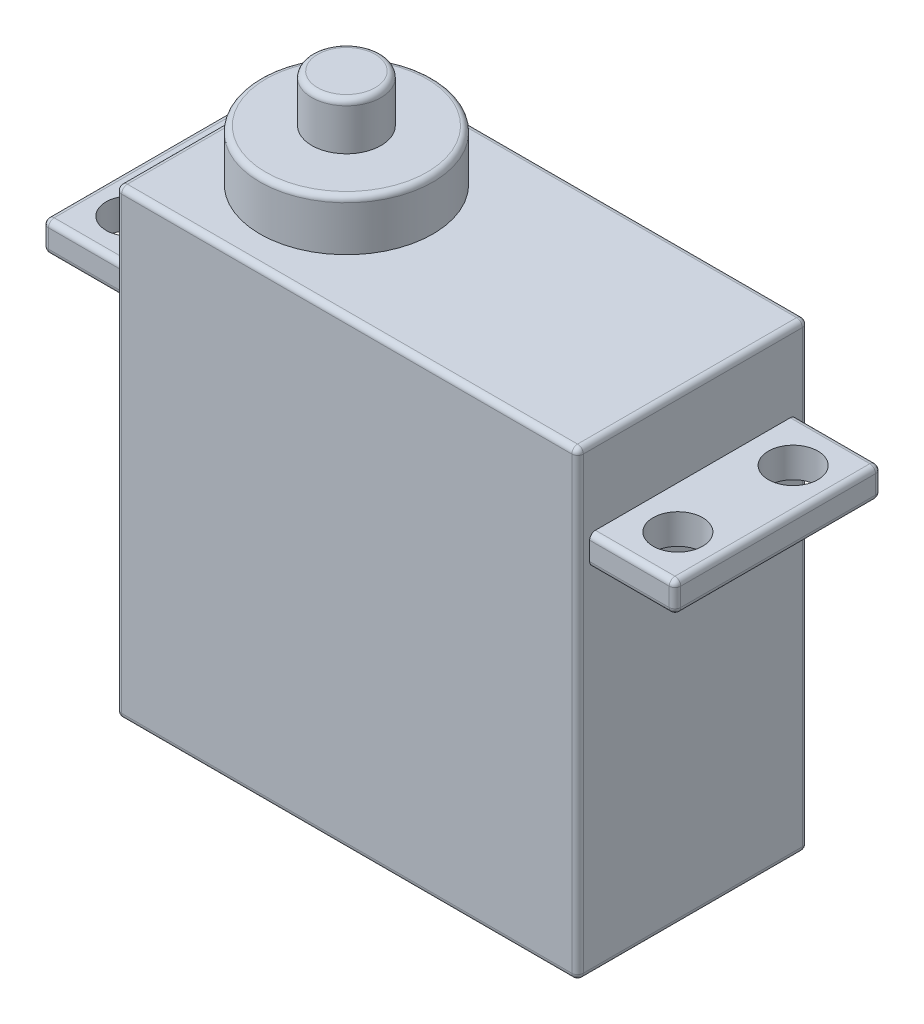
from build123d import *

# Parameters (mm, degrees)
SKETCH1_W           = 40.05
SKETCH1_H           = 20
SKETCH1_R           = 7.5
SKETCH1_R_2         = 3
BOSS_EXTRUDE1_DEPTH = 40
BOSS_EXTRUDE2_START = -6.75
SKETCH1_3_W         = 7.4
SKETCH1_3_H         = 17.9
SKETCH1_3_R         = 2.15
BOSS_EXTRUDE2_DEPTH = 2.6
SKETCH1_4_R         = 7.5
SKETCH1_4_R_2       = 3
BOSS_EXTRUDE3_DEPTH = 4.4
BOSS_EXTRUDE4_START = 4.4
SKETCH1_5_R         = 3
BOSS_EXTRUDE4_DEPTH = 4.1
FILLET1_R           = 0.5


with BuildPart() as part:
    # Sketch1 → Boss-Extrude1 (new body)
    # profile 1 of 3: a face of its own
    with BuildSketch(Plane(origin=(0, 0, 0), x_dir=(1, 0, 0), z_dir=(0, 1, 0))):
        Rectangle(SKETCH1_W, SKETCH1_H)
        with Locations((-10.025, 0)):
            Circle(SKETCH1_R, mode=Mode.SUBTRACT)
    # profile 2 of 3: a face of its own
    with BuildSketch(Plane(origin=(0, 0, 0), x_dir=(1, 0, 0), z_dir=(0, 1, 0))):
        with Locations((-10.025, 0)):
            Circle(SKETCH1_R)
        with Locations((-10.025, 0)):
            Circle(SKETCH1_R_2, mode=Mode.SUBTRACT)
    # profile 3 of 3: a face of its own
    with BuildSketch(Plane(origin=(0, 0, 0), x_dir=(1, 0, 0), z_dir=(0, 1, 0))):
        with Locations((-10.025, 0)):
            Circle(SKETCH1_R_2)
    extrude(amount=-BOSS_EXTRUDE1_DEPTH)

    # Sketch1<3> → Boss-Extrude2 (add)
    # profile 1 of 2: a face of its own
    with BuildSketch(Plane(origin=(0, 0, 0), x_dir=(1, 0, 0), z_dir=(0, 1, 0)).offset(BOSS_EXTRUDE2_START)):
        with Locations((-23.725, 0)):
            Rectangle(SKETCH1_3_W, SKETCH1_3_H)
        with Locations(Location((-23.725, -5, 0), (0, 0, 270))):
            Circle(SKETCH1_3_R, mode=Mode.SUBTRACT)
        with Locations(Location((-23.725, 5, 0), (0, 0, 270))):
            Circle(SKETCH1_3_R, mode=Mode.SUBTRACT)
    # profile 2 of 2: a face of its own
    with BuildSketch(Plane(origin=(0, 0, 0), x_dir=(1, 0, 0), z_dir=(0, 1, 0)).offset(BOSS_EXTRUDE2_START)):
        with Locations((23.725, 0)):
            Rectangle(SKETCH1_3_W, SKETCH1_3_H)
        with Locations(Location((23.725, -5, 0), (0, 0, 270))):
            Circle(SKETCH1_3_R, mode=Mode.SUBTRACT)
        with Locations(Location((23.725, 5, 0), (0, 0, 270))):
            Circle(SKETCH1_3_R, mode=Mode.SUBTRACT)
    extrude(amount=-BOSS_EXTRUDE2_DEPTH)

    # Sketch1<4> → Boss-Extrude3 (add)
    # profile 1 of 2: a face of its own
    with BuildSketch(Plane(origin=(0, 0, 0), x_dir=(1, 0, 0), z_dir=(0, 1, 0))):
        with Locations(Location((-10.025, 0, 0), (0, 0, 270))):
            Circle(SKETCH1_4_R)
        with Locations((-10.025, 0)):
            Circle(SKETCH1_4_R_2, mode=Mode.SUBTRACT)
    # profile 2 of 2: a face of its own
    with BuildSketch(Plane(origin=(0, 0, 0), x_dir=(1, 0, 0), z_dir=(0, 1, 0))):
        with Locations((-10.025, 0)):
            Circle(SKETCH1_4_R_2)
    extrude(amount=BOSS_EXTRUDE3_DEPTH)

    # Sketch1<5> → Boss-Extrude4 (add)
    with BuildSketch(Plane(origin=(0, 0, 0), x_dir=(1, 0, 0), z_dir=(0, 1, 0)).offset(BOSS_EXTRUDE4_START)):
        with Locations(Location((-10.025, 0, 0), (0, 0, 270))):
            Circle(SKETCH1_5_R)
    extrude(amount=BOSS_EXTRUDE4_DEPTH)

    # Fillet1
    fillet1_edges = [part.edges().sort_by_distance(p)[0] for p in [
        (20.025, -40, 0),
        (0, -40, -10),
        (-27.425, -6.75, 0),
        (-27.425, -8.05, 8.95),
        (-23.725, -9.35, -8.95),
        (-27.425, -8.05, -8.95),
        (-23.725, -6.75, 8.95),
        (-20.025, -40, 0),
        (-27.425, -9.35, 0),
        (-23.725, -9.35, 8.95),
        (-23.725, -6.75, -8.95),
        (23.725, -6.75, -8.95),
        (27.425, -9.35, 0),
        (27.425, -8.05, -8.95),
        (23.725, -9.35, 8.95),
        (27.425, -8.05, 8.95),
        (23.725, -9.35, -8.95),
        (23.725, -6.75, 8.95),
        (27.425, -6.75, 0),
        (0, -40, 10),
        (-10.025, 4.4, -7.5),
        (-10.025, 8.5, -3),
        (-20.025, 0, 0),
        (0, 0, -10),
        (20.025, 0, 0),
        (0, 0, 10),
        (-20.025, -20, 10),
        (-20.025, -20, -10),
        (20.025, -20, -10),
        (20.025, -20, 10),
    ]]
    fillet(fillet1_edges, radius=FILLET1_R)


solid = part.part
